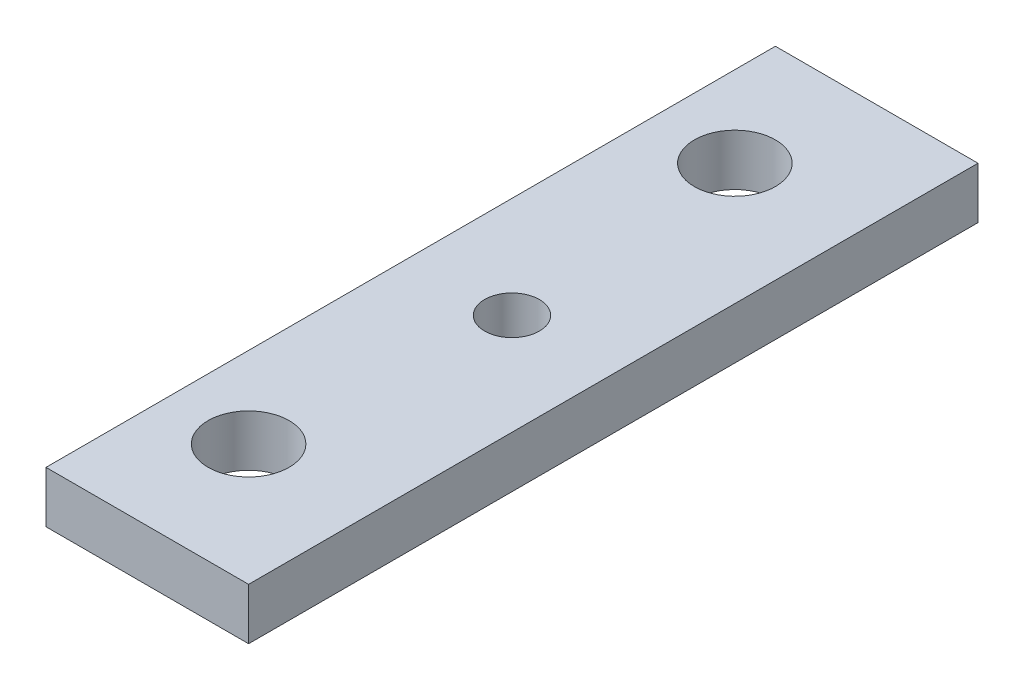
from build123d import *

# Parameters (mm, degrees)
CROQUIS1_W              = 50
CROQUIS1_H              = 180
CROQUIS1_R              = 10
CROQUIS1_R_2            = 6.759687503
SALIENTE_EXTRUIR1_DEPTH = 12.7


with BuildPart() as part:
    # Croquis1 → Saliente-Extruir1 (new body)
    with BuildSketch(Plane(origin=(0, 0, 0), x_dir=(1, 0, 0), z_dir=(0, 1, 0))):
        Rectangle(CROQUIS1_W, CROQUIS1_H)
        with Locations(Location((-5, 60, 0), (0, 0, 270))):
            Circle(CROQUIS1_R, mode=Mode.SUBTRACT)
        with Locations(Location((-5, -60, 0), (0, 0, 270))):
            Circle(CROQUIS1_R, mode=Mode.SUBTRACT)
        with Locations(Location((0, 0, 0), (0, 0, 270))):
            Circle(CROQUIS1_R_2, mode=Mode.SUBTRACT)
    extrude(amount=SALIENTE_EXTRUIR1_DEPTH)


solid = part.part
